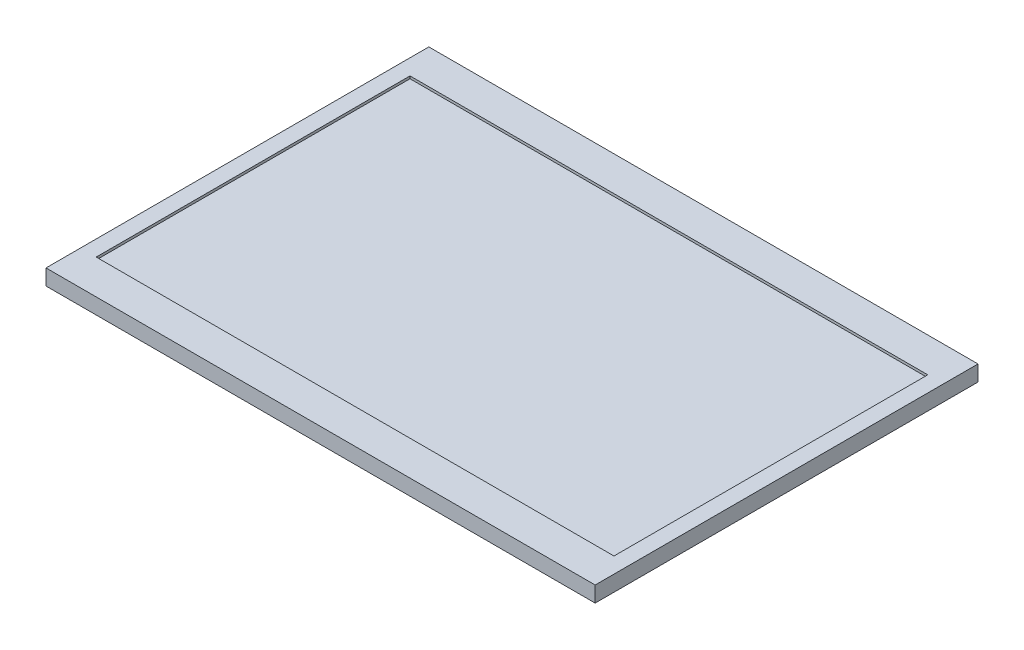
from build123d import *

# Parameters (mm, degrees)
CROQUIS1_W              = 10
CROQUIS1_H              = 18.019237886
SALIENTE_EXTRUIR1_DEPTH = 12
CORTAR_EXTRUIR1_REACH   = 99.669
CROQUIS2_R              = 1.55
CORTAR_EXTRUIR2_REACH   = 103.09
CROQUIS3_R              = 1.55
CORTAR_EXTRUIR3_REACH   = 91.077
CROQUIS4_R              = 1.55
CROQUIS6_W              = 175
CROQUIS6_H              = 122
SALIENTE_EXTRUIR7_DEPTH = 5
REDONDEO1_R             = 2
REDONDEO2_R             = 1
CROQUIS7_W              = 165
CROQUIS7_H              = 100
CORTAR_EXTRUIR4_DEPTH   = 0.8


with BuildPart() as part:
    # Croquis1 → Saliente-Extruir1 (new body)
    with BuildSketch(Plane(origin=(0, 0, 0), x_dir=(1, 0, 0), z_dir=(0, 1, 0))):
        Polygon((5, 49), (-5, 49), (-5, 61), (-15, 61), (-15, 25.980762114), (-30, 0), (-60.327549631, -17.509618943), (-55.327549631, -26.169872981), (-44.935244785, -20.169872981), (-39.935244785, -28.830127019), (-50.327549631, -34.830127019), (-45.327549631, -43.490381057), (-15, -25.980762114), (15, -25.980762114), (45.327549631, -43.490381057), (50.327549631, -34.830127019), (39.935244785, -28.830127019), (44.935244785, -20.169872981), (55.327549631, -26.169872981), (60.327549631, -17.509618943), (30, 0), (15, 25.980762114), (15, 61), (5, 61), align=None)
        Polygon((-40.605117767, -17.669872981), (-25, -8.660254038), (-20, -17.320508076), (-35.605117767, -26.330127019), align=None, mode=Mode.SUBTRACT)
        Polygon((10.103629711, 17.5), (20.207259422, 0), (10.103629711, -17.5), (-10.103629711, -17.5), (-20.207259422, 0), (-10.103629711, 17.5), align=None, mode=Mode.SUBTRACT)
        Polygon((25, -8.660254038), (40.605117767, -17.669872981), (35.605117767, -26.330127019), (20, -17.320508076), align=None, mode=Mode.SUBTRACT)
        with Locations((0, 34.990381057)):
            Rectangle(CROQUIS1_W, CROQUIS1_H, mode=Mode.SUBTRACT)
    extrude(amount=SALIENTE_EXTRUIR1_DEPTH)

    # Cortar-Extruir1: up to this face of the body (flat: up to its plane)
    cortar_extruir1_end = Plane(part.part.faces().sort_by_distance((15, 6, -43.490381057))[0])
    # Croquis2 → Cortar-Extruir1 (cut, up to the picked face)
    with BuildSketch(Plane.ZY.offset(15), mode=Mode.PRIVATE) as cortar_extruir1_sk1:
        with Locations((-55, 5)):
            Circle(CROQUIS2_R)
    cortar_extruir1_tool1 = split(extrude(cortar_extruir1_sk1.sketch, amount=-CORTAR_EXTRUIR1_REACH, mode=Mode.PRIVATE), bisect_by=cortar_extruir1_end, keep=Keep.BOTH, mode=Mode.PRIVATE)
    add(cortar_extruir1_tool1.solids().sort_by(Axis((-15, 5, -55), (1, 0, 0)))[0], mode=Mode.SUBTRACT)

    # Cortar-Extruir2: up to this face of the body (flat: up to its plane)
    cortar_extruir2_end = Plane(part.part.faces().sort_by_distance((-45.163774815, 6, 8.754809472))[0])
    # Croquis3 → Cortar-Extruir2 (cut, up to the picked face)
    with BuildSketch(Plane(origin=(7.5, 0, 12.990381057), x_dir=(0.8660254037844382, 0, -0.5000000000000007), z_dir=(0.5000000000000008, 0, 0.8660254037844383)), mode=Mode.PRIVATE) as cortar_extruir2_sk1:
        with Locations((-55, 5)):
            Circle(CROQUIS3_R)
    cortar_extruir2_tool1 = split(extrude(cortar_extruir2_sk1.sketch, amount=-CORTAR_EXTRUIR2_REACH, mode=Mode.PRIVATE), bisect_by=cortar_extruir2_end, keep=Keep.BOTH, mode=Mode.PRIVATE)
    add(cortar_extruir2_tool1.solids().sort_by(Axis((-40.131397, 5, 40.490381), (-0.5000000000000008, 0, -0.8660254037844383)))[0], mode=Mode.SUBTRACT)

    # Cortar-Extruir3: up to this face of the body (flat: up to its plane)
    cortar_extruir3_end = Plane(part.part.faces().sort_by_distance((30.163774815, 6, 34.735571585))[0])
    # Croquis4 → Cortar-Extruir3 (cut, up to the picked face)
    with BuildSketch(Plane(origin=(7.5, 0, -12.990381057), x_dir=(-0.8660254037844407, 0, -0.4999999999999965), z_dir=(0.49999999999999656, 0, -0.8660254037844407)), mode=Mode.PRIVATE) as cortar_extruir3_sk1:
        with Locations((-55, 5)):
            Circle(CROQUIS4_R)
    cortar_extruir3_tool1 = split(extrude(cortar_extruir3_sk1.sketch, amount=-CORTAR_EXTRUIR3_REACH, mode=Mode.PRIVATE), bisect_by=cortar_extruir3_end, keep=Keep.BOTH, mode=Mode.PRIVATE)
    add(cortar_extruir3_tool1.solids().sort_by(Axis((55.131397, 5, 14.509619), (-0.49999999999999656, 0, 0.8660254037844407)))[0], mode=Mode.SUBTRACT)

    # Croquis6 → Saliente-Extruir7 (add)
    with BuildSketch(Plane(origin=(0, 12, 0), x_dir=(1, 0, 0), z_dir=(0, 1, 0))):
        Rectangle(CROQUIS6_W, CROQUIS6_H)
    extrude(amount=SALIENTE_EXTRUIR7_DEPTH)

    # Redondeo1
    redondeo1_edges = [part.edges().sort_by_distance(p)[0] for p in [
        (35.605117767, 6, 26.330127019),
        (40.605117767, 6, 17.669872981),
        (25, 6, 8.660254038),
        (20, 6, 17.320508076),
        (-35.605117767, 6, 26.330127019),
        (-20, 6, 17.320508076),
        (-25, 6, 8.660254038),
        (-40.605117767, 6, 17.669872981),
        (-5, 6, -25.980762114),
        (5, 6, -25.980762114),
        (5, 6, -44),
        (-5, 6, -44),
    ]]
    fillet(redondeo1_edges, radius=REDONDEO1_R)

    # Redondeo2
    redondeo2_edges = [part.edges().sort_by_distance(p)[0] for p in [
        (-15, 6, -61),
        (-5, 6, -61),
        (-5, 6, -49),
        (5, 6, -49),
        (5, 6, -61),
        (15, 6, -61),
        (60.327549631, 6, 17.509618943),
        (55.327549631, 6, 26.169872981),
        (44.935244785, 6, 20.169872981),
        (39.935244785, 6, 28.830127019),
        (50.327549631, 6, 34.830127019),
        (45.327549631, 6, 43.490381057),
        (-45.327549631, 6, 43.490381057),
        (-50.327549631, 6, 34.830127019),
        (-39.935244785, 6, 28.830127019),
        (-44.935244785, 6, 20.169872981),
        (-55.327549631, 6, 26.169872981),
        (-60.327549631, 6, 17.509618943),
    ]]
    fillet(redondeo2_edges, radius=REDONDEO2_R)

    # Croquis7 → Cortar-Extruir4 (cut)
    with BuildSketch(Plane(origin=(0, 17, 0), x_dir=(1, 0, 0), z_dir=(0, 1, 0))):
        Rectangle(CROQUIS7_W, CROQUIS7_H)
    extrude(amount=-CORTAR_EXTRUIR4_DEPTH, mode=Mode.SUBTRACT)


solid = part.part
